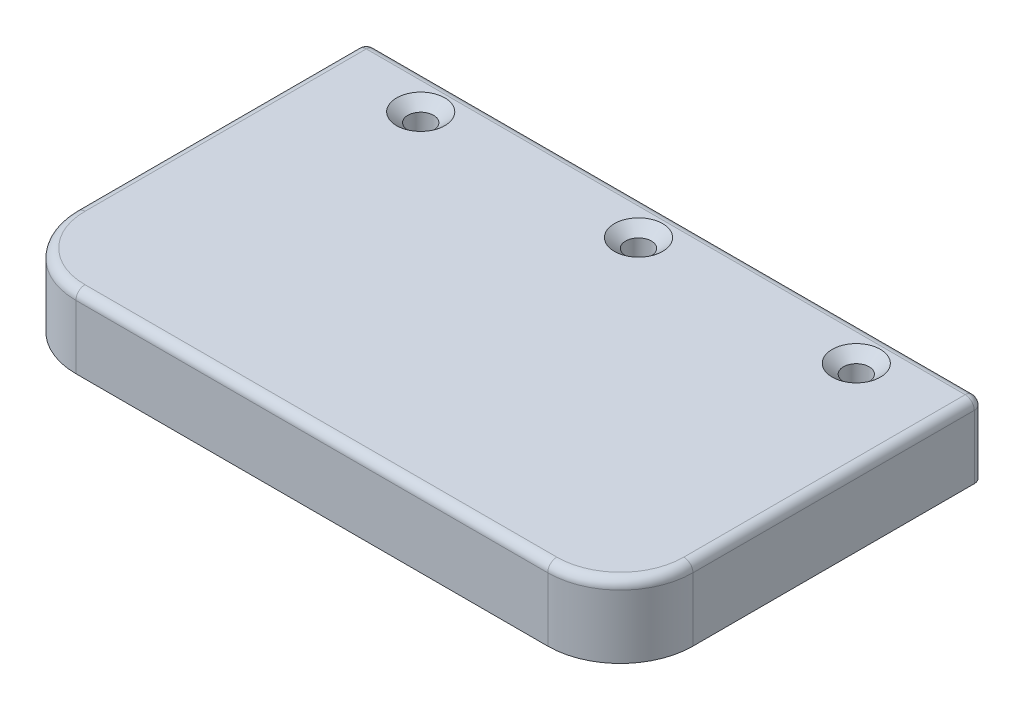
from build123d import *

# Parameters (mm, degrees)
SKETCH1_W                                         = 107.95
SKETCH1_H                                         = 12.7
BOSS_EXTRUDE1_DEPTH                               = 31.75
FILLET1_R                                         = 12.7
CSK_FOR_8_FLAT_HEAD_MACHINE_SCREW_100_D           = 4.4958
CSK_FOR_8_FLAT_HEAD_MACHINE_SCREW_100_DEPTH       = 19.05
CSK_FOR_8_FLAT_HEAD_MACHINE_SCREW_100_CSINK_D     = 8.4328
CSK_FOR_8_FLAT_HEAD_MACHINE_SCREW_100_CSINK_ANGLE = 100
CSK_FOR_8_FLAT_HEAD_MACHINE_SCREW_100_TIP         = 1.350674586
FILLET2_R                                         = 1.5875


with BuildPart() as part:
    # Sketch1 → Boss-Extrude1 (new, symmetric)
    with BuildSketch(Plane.XY):
        Rectangle(SKETCH1_W, SKETCH1_H)
    extrude(amount=BOSS_EXTRUDE1_DEPTH, both=True)

    # Fillet1
    fillet1_edges = [part.edges().sort_by_distance(p)[0] for p in [
        (-53.975, 0, 31.75),
        (53.975, 0, 31.75),
    ]]
    fillet(fillet1_edges, radius=FILLET1_R)

    # CSK for #8 Flat Head Machine Screw (100)1
    with Locations(Plane(origin=(0, 6.35, 0), x_dir=(1, 0, 0), z_dir=(0, 1, 0))):
        with Locations((-38.1, 25.4), (38.1, 25.4), (0, 25.4)):
            CounterSinkHole(CSK_FOR_8_FLAT_HEAD_MACHINE_SCREW_100_D / 2, CSK_FOR_8_FLAT_HEAD_MACHINE_SCREW_100_CSINK_D / 2, depth=CSK_FOR_8_FLAT_HEAD_MACHINE_SCREW_100_DEPTH, counter_sink_angle=CSK_FOR_8_FLAT_HEAD_MACHINE_SCREW_100_CSINK_ANGLE)
            with Locations((0, 0, -(CSK_FOR_8_FLAT_HEAD_MACHINE_SCREW_100_DEPTH + CSK_FOR_8_FLAT_HEAD_MACHINE_SCREW_100_TIP / 2))):  # 118° drill point
                Cone(0, CSK_FOR_8_FLAT_HEAD_MACHINE_SCREW_100_D / 2, CSK_FOR_8_FLAT_HEAD_MACHINE_SCREW_100_TIP, mode=Mode.SUBTRACT)

    # Fillet2
    fillet2_edges = [part.edges().sort_by_distance(p)[0] for p in [
        (0, 6.35, 31.75),
        (-53.975, 6.35, -6.35),
        (53.975, 6.35, -6.35),
        (50.255256121, 6.35, 28.030256121),
        (-50.255256121, 6.35, 28.030256121),
        (-53.975, 0, -31.75),
        (0, 6.35, -31.75),
        (53.975, 0, -31.75),
    ]]
    fillet(fillet2_edges, radius=FILLET2_R)


solid = part.part
